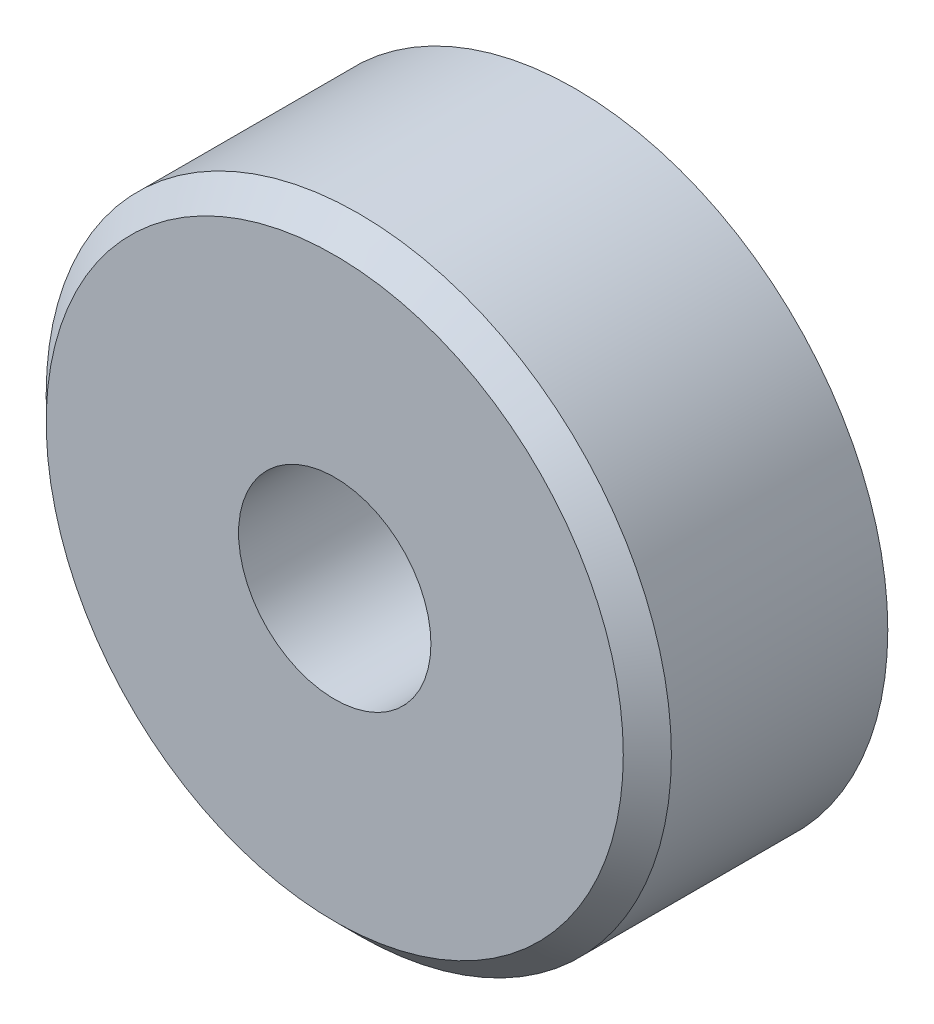
from build123d import *

# Parameters (mm, degrees)
SKETCH1_R           = 3.25
SKETCH1_R_2         = 1
BOSS_EXTRUDE1_DEPTH = 2.5
CHAMFER1_SIZE       = 0.25


with BuildPart() as part:
    # Sketch1 → Boss-Extrude1 (new body)
    with BuildSketch(Plane.XY):
        Circle(SKETCH1_R)
        Circle(SKETCH1_R_2, mode=Mode.SUBTRACT)
    extrude(amount=BOSS_EXTRUDE1_DEPTH)

    # Chamfer1
    chamfer1_edges = [part.edges().sort_by_distance(p)[0] for p in [
        (-3.25, 0, 2.5),
    ]]
    chamfer(chamfer1_edges, length=CHAMFER1_SIZE)


solid = part.part
